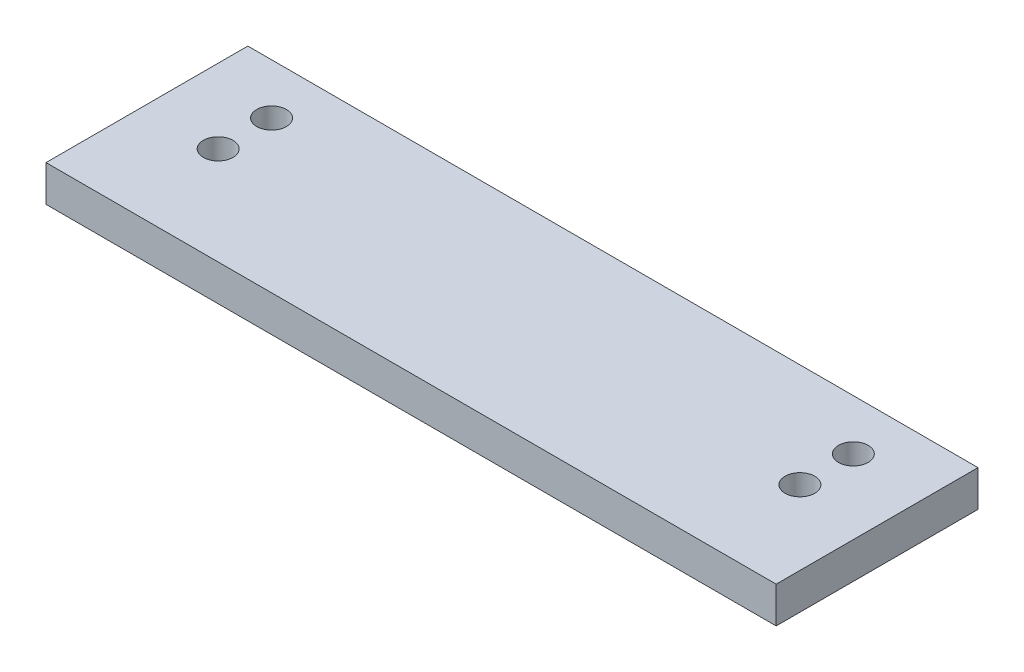
from build123d import *

# Parameters (mm, degrees)
SKETCH3_W           = 61.5
SKETCH3_H           = 17
BOSS_EXTRUDE1_DEPTH = 3.05
SKETCH4_R           = 1.25
CUT_EXTRUDE1_DEPTH  = 64.879202406


with BuildPart() as part:
    # Sketch3 → Boss-Extrude1 (new body)
    with BuildSketch(Plane(origin=(0, 0, 0), x_dir=(1, 0, 0), z_dir=(0, 1, 0))):
        with Locations((30.75, 8.5)):
            Rectangle(SKETCH3_W, SKETCH3_H)
    extrude(amount=BOSS_EXTRUDE1_DEPTH)

    # Sketch4 → Cut-Extrude1 (cut, through all)
    with BuildSketch(Plane(origin=(0, 3.05, 0), x_dir=(1, 0, 0), z_dir=(0, 1, 0))):
        with Locations(Location((6.25, 12.75, 0), (0, 0, 270))):
            Circle(SKETCH4_R)
        with Locations(Location((6.25, 8.25, 0), (0, 0, 270))):
            Circle(SKETCH4_R)
        with Locations(Location((55.25, 12.75, 0), (0, 0, 270))):
            Circle(SKETCH4_R)
        with Locations(Location((55.25, 8.25, 0), (0, 0, 270))):
            Circle(SKETCH4_R)
    extrude(amount=-CUT_EXTRUDE1_DEPTH, mode=Mode.SUBTRACT)


solid = part.part
